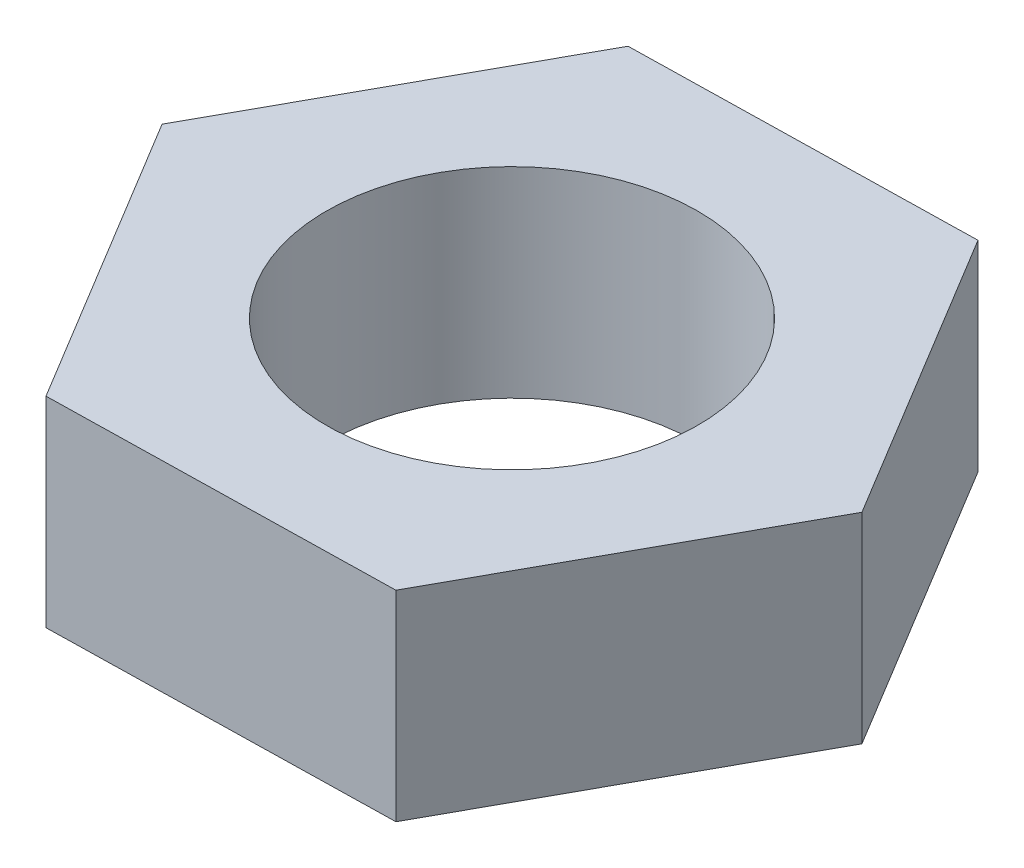
from build123d import *

# Parameters (mm, degrees)
SKETCH1_R           = 2.5
BOSS_EXTRUDE1_DEPTH = 2.7


with BuildPart() as part:
    # Sketch1 → Boss-Extrude1 (new body)
    with BuildSketch(Plane(origin=(0, 0, 0), x_dir=(1, 0, 0), z_dir=(0, 1, 0))):
        Polygon((2.389857557, -3.952456729), (4.617856713, 0.093448991), (2.227999156, 4.04590572), (-2.389857557, 3.952456729), (-4.617856713, -0.093448991), (-2.227999156, -4.04590572), align=None)
        with Locations(Location((0, 0, 0), (0, 0, 90))):
            Circle(SKETCH1_R, mode=Mode.SUBTRACT)
    extrude(amount=BOSS_EXTRUDE1_DEPTH)


solid = part.part
